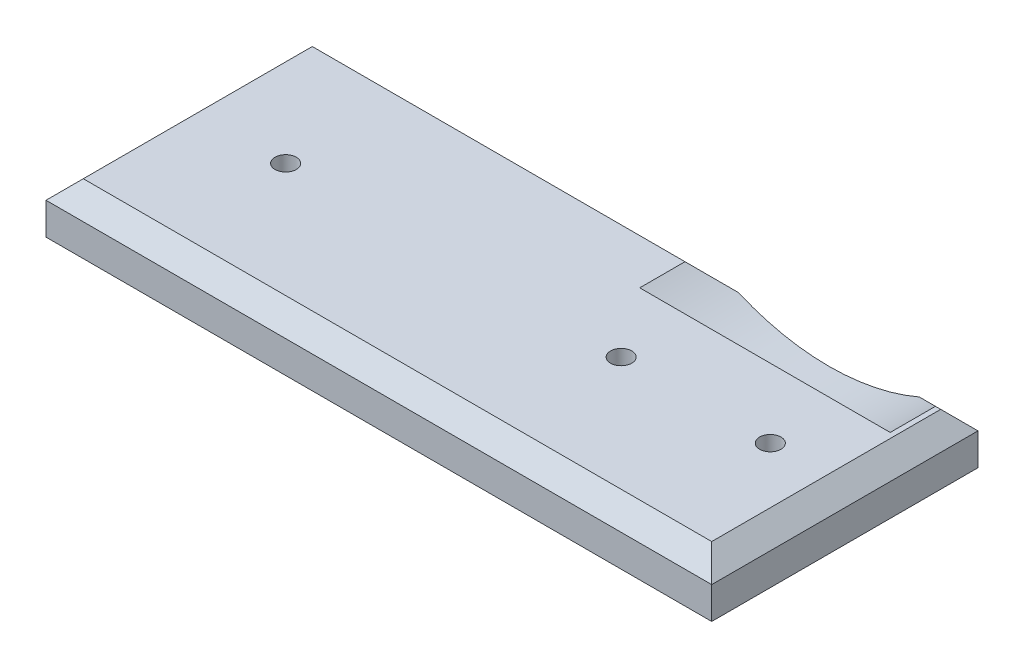
from build123d import *

# Parameters (mm, degrees)
SKETCH1_W           = 125
SKETCH1_H           = 50
BOSS_EXTRUDE1_DEPTH = 9.5
CHAMFER1_SIZE       = 3.5
SKETCH3_R           = 4
CUT_EXTRUDE2_DEPTH  = 4
SKETCH4_R           = 2
CUT_EXTRUDE3_DEPTH  = 68.538877693
SKETCH6_R           = 43
CUT_EXTRUDE4_DEPTH  = 12


with BuildPart() as part:
    # Sketch1 → Boss-Extrude1 (new body)
    with BuildSketch(Plane(origin=(0, 0, 0), x_dir=(1, 0, 0), z_dir=(0, 1, 0))):
        Rectangle(SKETCH1_W, SKETCH1_H)
    extrude(amount=BOSS_EXTRUDE1_DEPTH)

    # Chamfer1
    chamfer1_edges = [part.edges().sort_by_distance(p)[0] for p in [
        (-62.5, 9.5, 0),
        (0, 9.5, 25),
        (62.5, 9.5, 0),
        (0, 9.5, -25),
    ]]
    chamfer(chamfer1_edges, length=CHAMFER1_SIZE)

    # Sketch3 → Cut-Extrude2 (cut)
    with BuildSketch(Plane.XZ):
        with Locations(Location((-42.5, 0, 0), (0, 0, 270))):
            Circle(SKETCH3_R)
        with Locations(Location((20.5, 0, 0), (0, 0, 270))):
            Circle(SKETCH3_R)
        with Locations(Location((48.5, 0, 0), (0, 0, 270))):
            Circle(SKETCH3_R)
    extrude(amount=-CUT_EXTRUDE2_DEPTH, mode=Mode.SUBTRACT)

    # Sketch4 → Cut-Extrude3 (cut, through all)
    with BuildSketch(Plane.XZ.offset(-4)):
        with Locations(Location((-42.5, 0, 0), (0, 0, 270))):
            Circle(SKETCH4_R)
        with Locations(Location((20.5, 0, 0), (0, 0, 270))):
            Circle(SKETCH4_R)
        with Locations(Location((48.5, 0, 0), (0, 0, 270))):
            Circle(SKETCH4_R)
    extrude(amount=-CUT_EXTRUDE3_DEPTH, mode=Mode.SUBTRACT)

    # Sketch6 → Cut-Extrude4 (cut)
    with BuildSketch(Plane(origin=(0, 0, -25), x_dir=(-1, 0, 0), z_dir=(0, 0, -1))):
        with Locations((-34.5, 45.5)):
            Circle(SKETCH6_R)
    extrude(amount=-CUT_EXTRUDE4_DEPTH, mode=Mode.SUBTRACT)


solid = part.part
